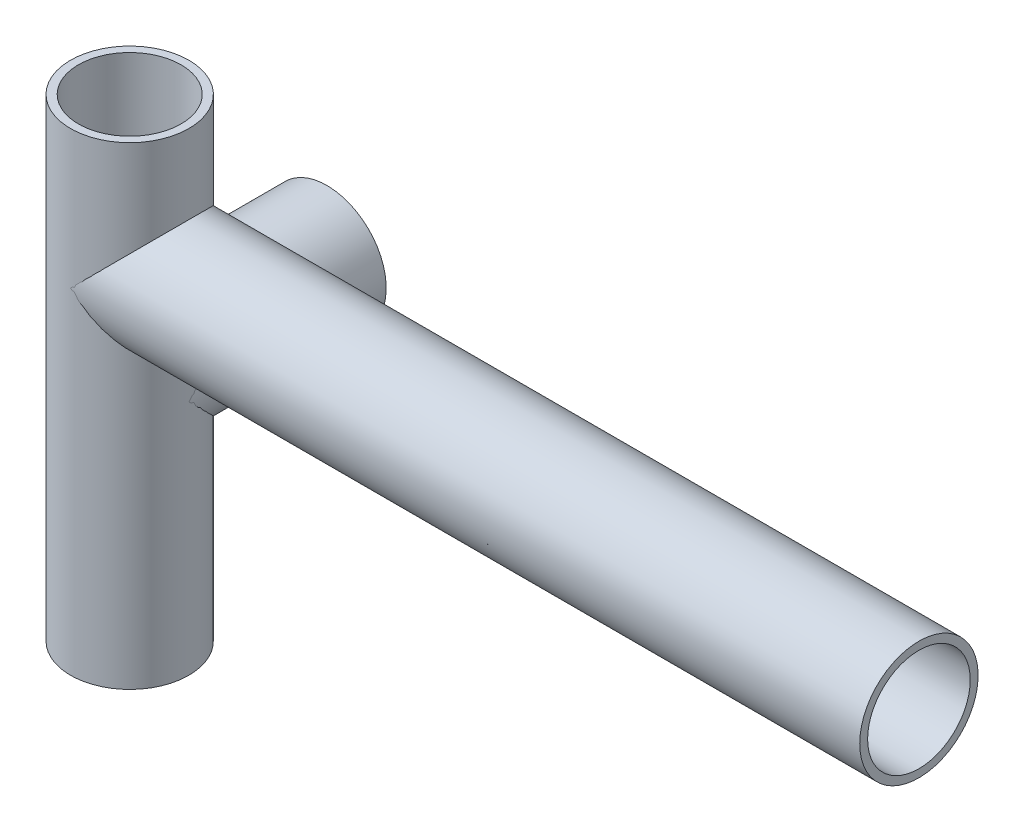
from build123d import *

# Parameters (mm, degrees)
SWEEP_THIN6_PROFILE_R   = 15
SWEEP_THIN6_PROFILE_R_2 = 13
SWEEP_THIN8_PROFILE_R   = 15
SWEEP_THIN8_PROFILE_R_2 = 13
CUT_EXTRUDE1_START      = -185
SKETCH135_R             = 15
CUT_EXTRUDE1_DEPTH      = 185
SWEEP_THIN9_PROFILE_R   = 15
SWEEP_THIN9_PROFILE_R_2 = 13
SKETCH183_R             = 15
CUT_EXTRUDE2_DEPTH      = 239.537208858


with BuildPart() as part:
    # Sweep-Thin6: sweep along a path in Sketch1
    with BuildLine(Plane(origin=(0, 0, 0), x_dir=(0, 0, -1), z_dir=(1, 0, 0))) as sweep_thin6_path:
        Line((0, 118.321595662), (0, -1.678404338))
    # Sweep-Thin6 profile (on start of the path) → Sweep-Thin6 (sweep)
    with BuildSketch(Plane(origin=(0, 118.321595662, 0), x_dir=(0, 0, -1), z_dir=(0, -1, 0))):
        Circle(SWEEP_THIN6_PROFILE_R)
        Circle(SWEEP_THIN6_PROFILE_R_2, mode=Mode.SUBTRACT)
    sweep(path=sweep_thin6_path.line)


with BuildPart() as body_2:
    # Sweep-Thin8: sweep along a path in Sketch66
    with BuildLine(Plane(origin=(0, 0, 0), x_dir=(0, 0, -1), z_dir=(1, 0, 0))) as sweep_thin8_path:
        Line((0, 58.321595662), (50, 58.321595662))
    # Sweep-Thin8 profile (on start of the path) → Sweep-Thin8 (sweep)
    with BuildSketch(Plane(origin=(0, 58.321595662, 0), x_dir=(-1, 0, 0), z_dir=(0, 0, -1))):
        Circle(SWEEP_THIN8_PROFILE_R)
        Circle(SWEEP_THIN8_PROFILE_R_2, mode=Mode.SUBTRACT)
    sweep(path=sweep_thin8_path.line)

    # Sketch135 → Cut-Extrude1 (cut)
    with BuildSketch(Plane(origin=(0, 118.321595662, 0), x_dir=(1, 0, 0), z_dir=(0, 1, 0)).offset(CUT_EXTRUDE1_START)):
        Circle(SKETCH135_R)
    extrude(amount=CUT_EXTRUDE1_DEPTH, mode=Mode.SUBTRACT)


with BuildPart() as body_3:
    # Sweep-Thin9: sweep along a path in Sketch142
    with BuildLine(Plane.XY) as sweep_thin9_path:
        Line((0, 58.321595662), (0, 83.321595662))
        Line((0, 83.321595662), (200, 83.321595662))
    # Sweep-Thin9 profile (on start of the path) → Sweep-Thin9 (sweep)
    with BuildSketch(Plane.ZX.offset(58.321595662)):
        Circle(SWEEP_THIN9_PROFILE_R)
        Circle(SWEEP_THIN9_PROFILE_R_2, mode=Mode.SUBTRACT)
    sweep(path=sweep_thin9_path.line, transition=Transition.RIGHT)

    # Sketch183 → Cut-Extrude2 (cut, through all)
    with BuildSketch(Plane(origin=(0, 118.321595662, 0), x_dir=(1, 0, 0), z_dir=(0, 1, 0))):
        Circle(SKETCH183_R)
    extrude(amount=-CUT_EXTRUDE2_DEPTH, mode=Mode.SUBTRACT)


solid = Compound([part.part, body_2.part, body_3.part])
